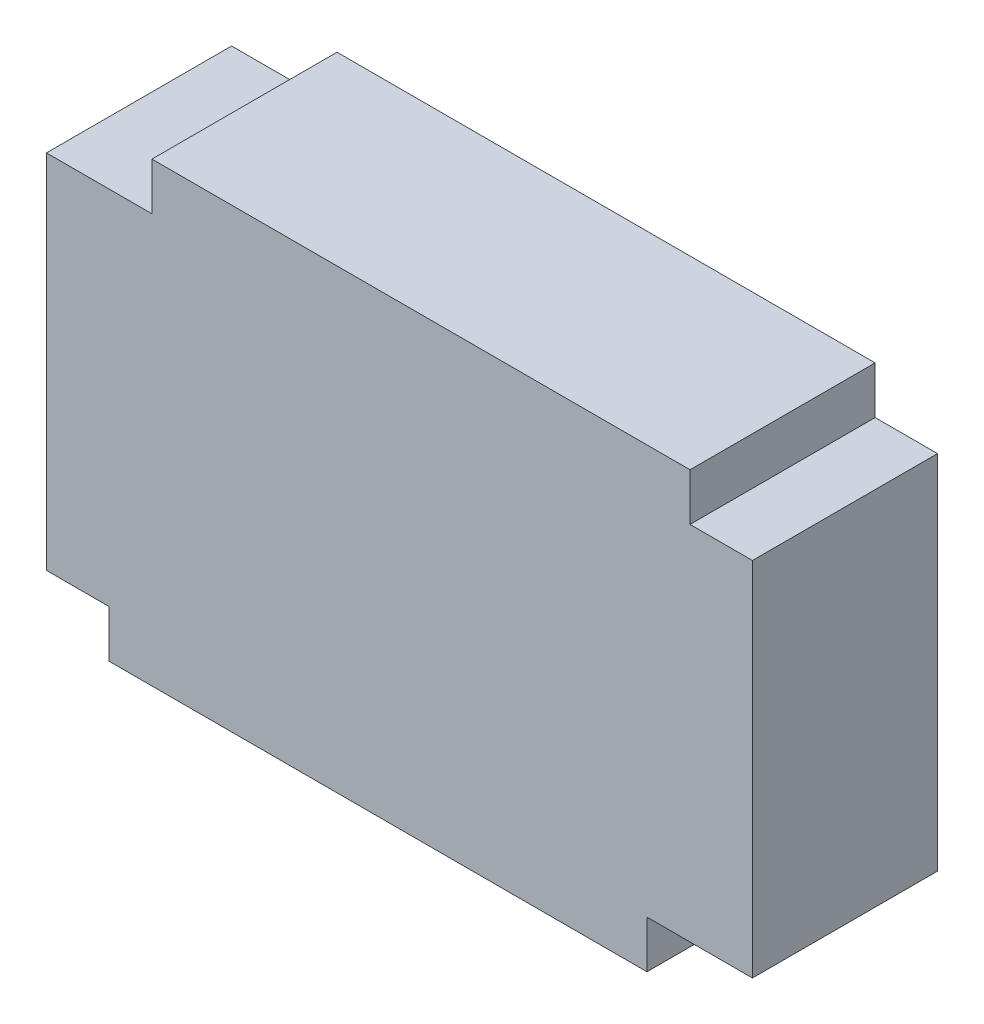
from build123d import *

# Parameters (mm, degrees)
COMPONENT_OUTLINE_DEPTH = 2.15


with BuildPart() as part:
    # 草图1 → Component_Outline (new body)
    with BuildSketch(Plane.XY):
        Polygon((2.875, -2.65), (2.875, -2.1), (4.1, -2.1), (4.1, 2.1), (3.375, 2.1), (3.375, 2.65), (-2.875, 2.65), (-2.875, 2.1), (-4.1, 2.1), (-4.1, -2.1), (-3.375, -2.1), (-3.375, -2.65), align=None)
    extrude(amount=COMPONENT_OUTLINE_DEPTH)


solid = part.part
